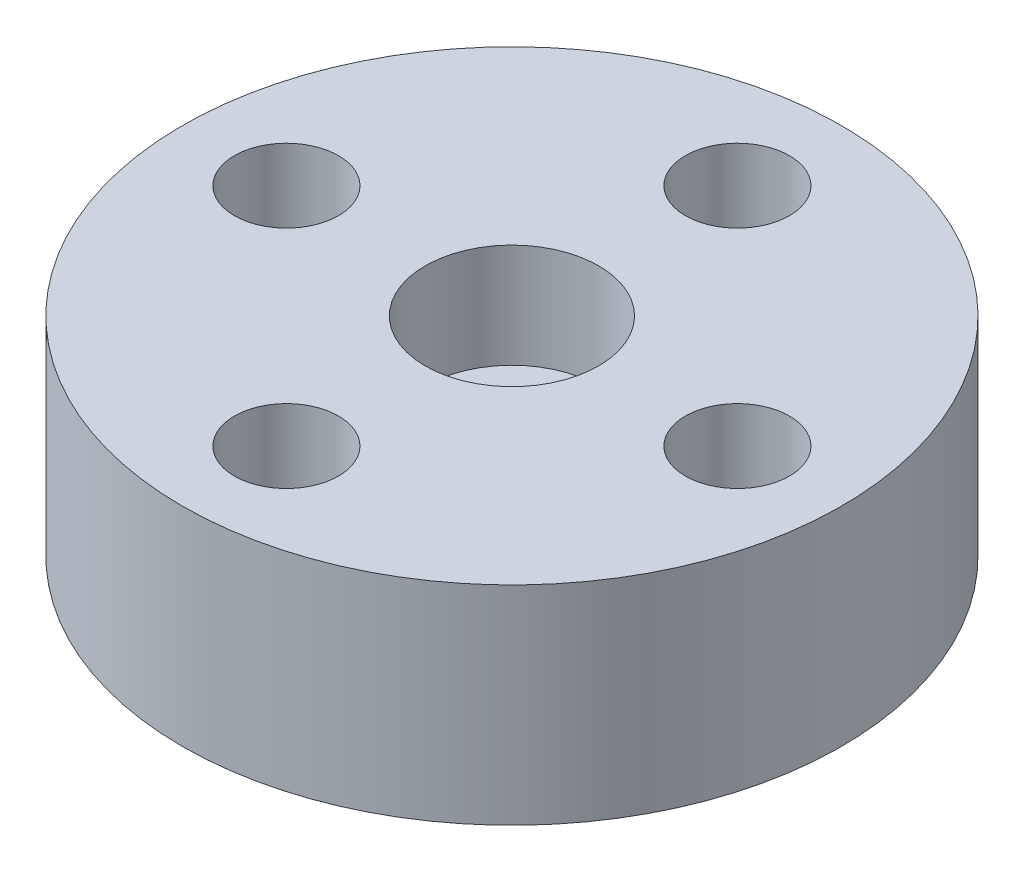
from build123d import *

# Parameters (mm, degrees)
SKETCH1_R           = 9.5
SKETCH1_R_2         = 1.5
BOSS_EXTRUDE1_DEPTH = 6
SKETCH2_R           = 2.5
CUT_EXTRUDE1_DEPTH  = 3


with BuildPart() as part:
    # Sketch1 → Boss-Extrude1 (new body)
    with BuildSketch(Plane(origin=(0, 0, 0), x_dir=(1, 0, 0), z_dir=(0, 1, 0))):
        with Locations(Location((0, 0, 0), (0, 0, 270))):
            Circle(SKETCH1_R)
        with Locations(Location((6.5, 0, 0), (0, 0, 270))):
            Circle(SKETCH1_R_2, mode=Mode.SUBTRACT)
        with Locations(Location((0, -6.5, 0), (0, 0, 270))):
            Circle(SKETCH1_R_2, mode=Mode.SUBTRACT)
        with Locations(Location((-6.5, 0, 0), (0, 0, 270))):
            Circle(SKETCH1_R_2, mode=Mode.SUBTRACT)
        with Locations(Location((0, 6.5, 0), (0, 0, 270))):
            Circle(SKETCH1_R_2, mode=Mode.SUBTRACT)
    extrude(amount=BOSS_EXTRUDE1_DEPTH)

    # Sketch2 → Cut-Extrude1 (cut)
    with BuildSketch(Plane(origin=(0, 6, 0), x_dir=(1, 0, 0), z_dir=(0, 1, 0))):
        with Locations(Location((0, 0, 0), (0, 0, 270))):
            Circle(SKETCH2_R)
    extrude(amount=-CUT_EXTRUDE1_DEPTH, mode=Mode.SUBTRACT)


solid = part.part
